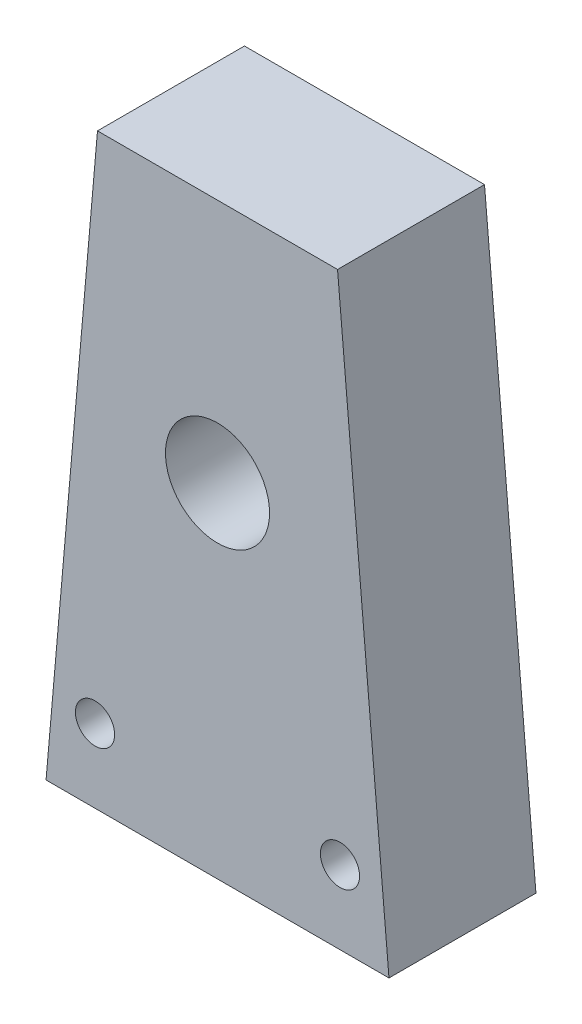
from build123d import *

# Parameters (mm, degrees)
BOSS_EXTRUDE1_DEPTH = 12
SKETCH2_R           = 4.25
SKETCH2_R_2         = 1.6
CUT_EXTRUDE2_DEPTH  = 13


with BuildPart() as part:
    # Sketch1 → Boss-Extrude1 (new body)
    with BuildSketch(Plane.XY):
        Polygon((-14, 0), (14, 0), (9.8, 48), (-9.8, 48), align=None)
    extrude(amount=BOSS_EXTRUDE1_DEPTH)

    # Sketch2 → Cut-Extrude2 (cut)
    with BuildSketch(Plane.XY):
        with Locations((0, 28)):
            Circle(SKETCH2_R)
        with Locations((10, 6)):
            Circle(SKETCH2_R_2)
        with Locations((-10, 6)):
            Circle(SKETCH2_R_2)
    extrude(amount=CUT_EXTRUDE2_DEPTH, mode=Mode.SUBTRACT)


solid = part.part
